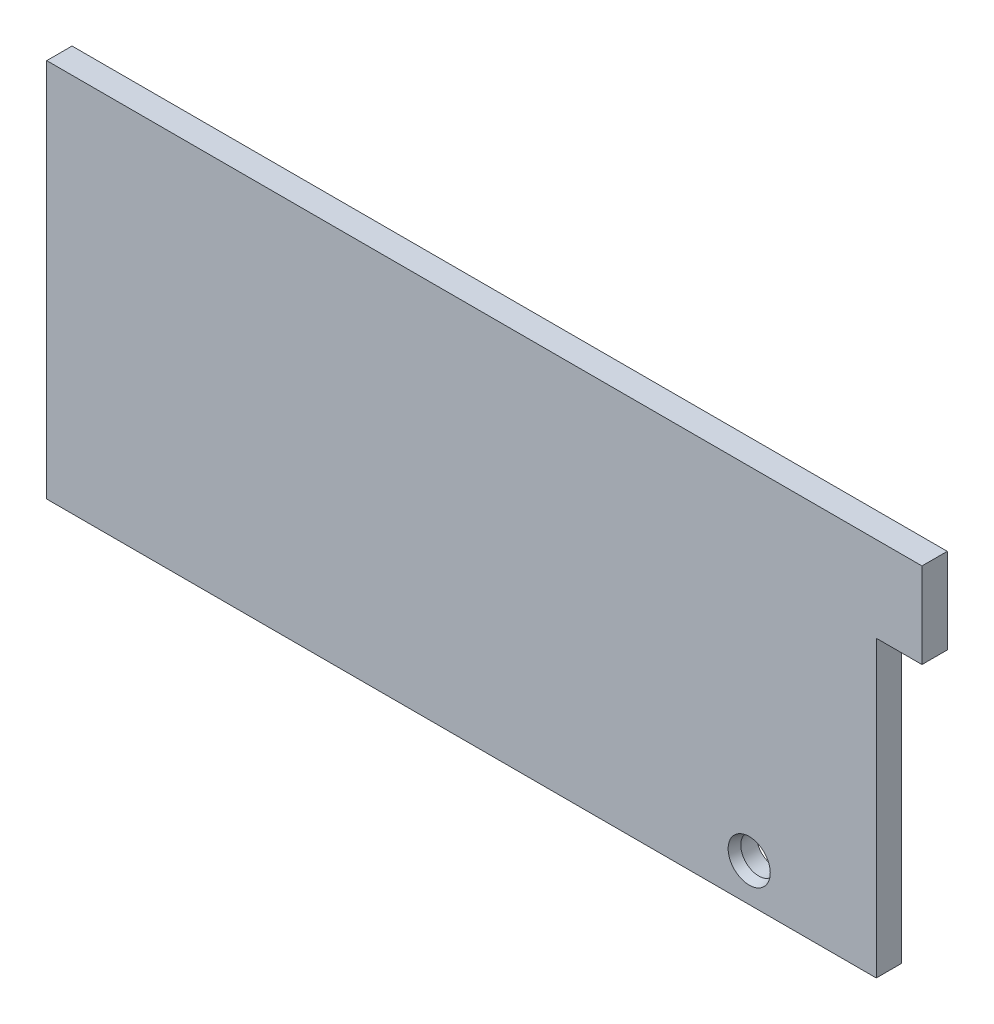
from build123d import *

# Parameters (mm, degrees)
SKETCH1_R           = 2.83
BOSS_EXTRUDE1_DEPTH = 2
CHAMFER1_SIZE       = 0.5
CHAMFER1_SIZE2      = 1.5


with BuildPart() as part:
    # Sketch1 → Boss-Extrude1 (new, symmetric)
    with BuildSketch(Plane.XY):
        Polygon((-81, -30), (50.07973639, -30), (50.07973639, 16.5), (57.3, 16.5), (57.3, 30), (-81, 30), align=None)
        with Locations((30, -24)):
            Circle(SKETCH1_R, mode=Mode.SUBTRACT)
    extrude(amount=BOSS_EXTRUDE1_DEPTH, both=True)

    # Chamfer1
    chamfer1_edges = [part.edges().sort_by_distance(p)[0] for p in [
        (27.17, -24, 2),
    ]]
    chamfer1_side = [part.faces().sort_by_distance(p)[0] for p in [
        (-14.755026682, 0.36160791, 2),
    ]]
    chamfer(chamfer1_edges, length=CHAMFER1_SIZE, length2=CHAMFER1_SIZE2, reference=chamfer1_side[0])


solid = part.part
